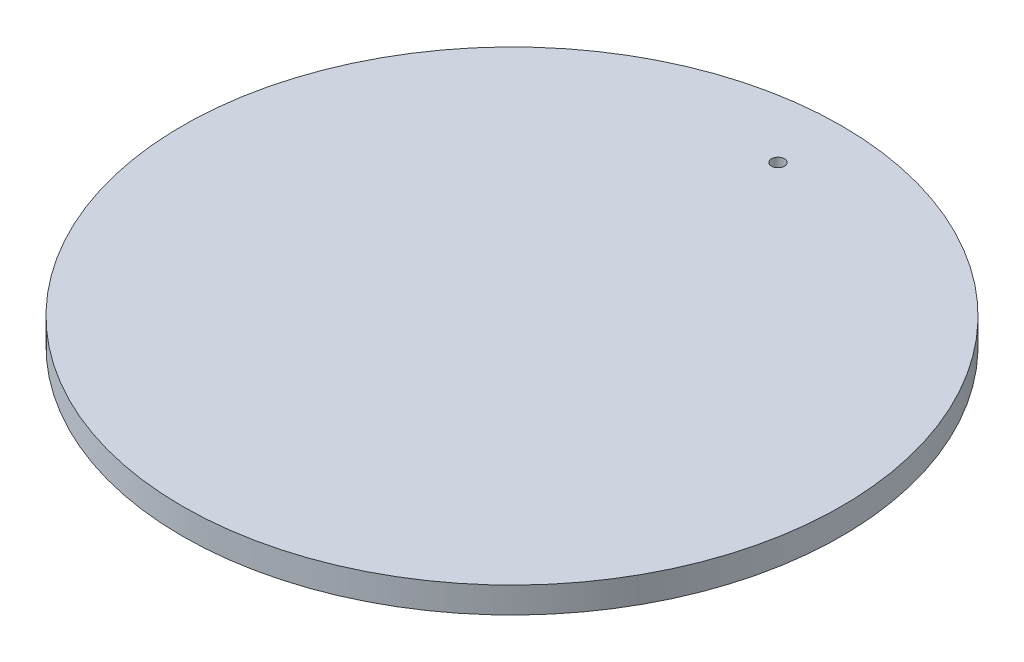
from build123d import *

# Parameters (mm, degrees)
SKETCH1_R               = 12.7
BOSS_EXTRUDE1_DEPTH     = 1
CUT_EXTRUDE3_DEPTH      = 18.98832955
CUT_EXTRUDE3_DEPTH_BACK = 18.98832955
SKETCH4_R               = 0.25


with BuildPart() as part:
    # Sketch1 → Boss-Extrude1 (new body)
    with BuildSketch(Plane(origin=(0, 0, 0), x_dir=(1, 0, 0), z_dir=(0, 1, 0))):
        with Locations(Location((0, 0, 0), (0, 0, 270))):
            Circle(SKETCH1_R)
    extrude(amount=BOSS_EXTRUDE1_DEPTH)

    # Sketch4 → Cut-Extrude3 (cut, two sides: drawn at the far end of the back side and taken through both)
    with BuildSketch(Plane(origin=(0, 1, 0), x_dir=(1, 0, 0), z_dir=(0, 1, 0)).offset(-CUT_EXTRUDE3_DEPTH_BACK)):
        with Locations(Location((0, 10.25, 0), (0, 0, 270))):
            Circle(SKETCH4_R)
    extrude(amount=CUT_EXTRUDE3_DEPTH + CUT_EXTRUDE3_DEPTH_BACK, mode=Mode.SUBTRACT)


solid = part.part
